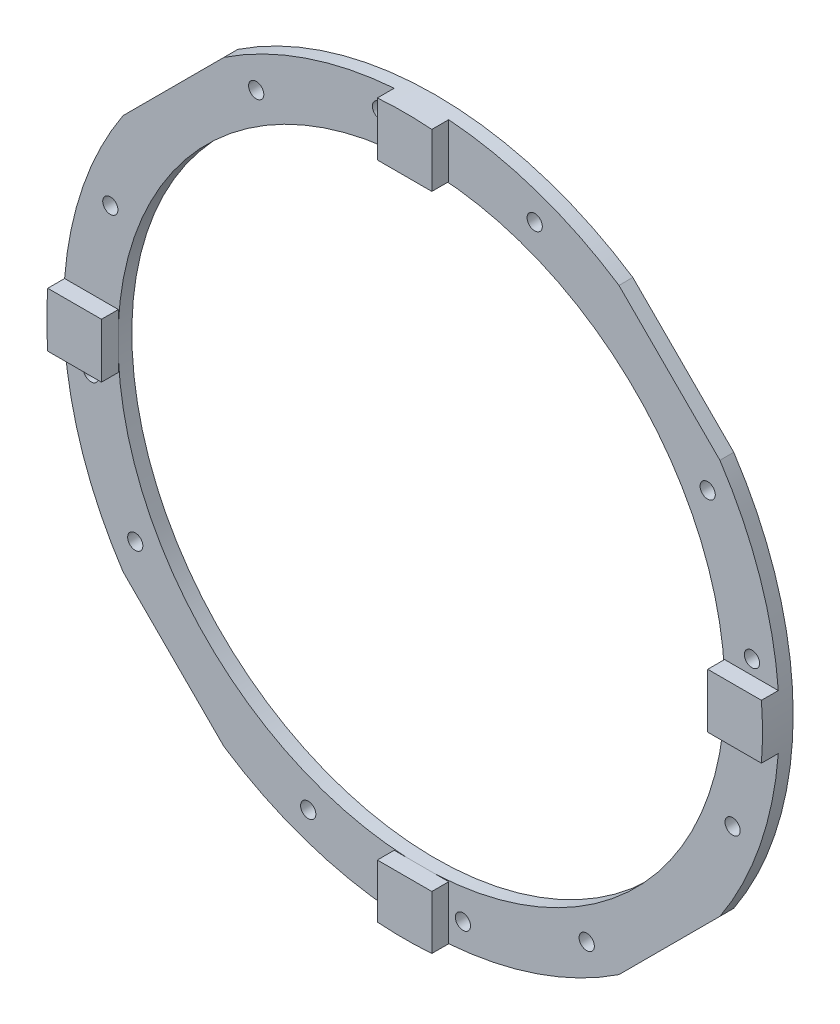
from build123d import *

# Parameters (mm, degrees)
SKETCH2_R           = 129.4
SKETCH2_R_2         = 109.725
SKETCH2_R_3         = 2.75
BOSS_EXTRUDE1_DEPTH = 5
BOSS_EXTRUDE2_DEPTH = 6.1
CUT_EXTRUDE3_DEPTH  = 10
SKETCH5_R           = 2.75
CUT_EXTRUDE4_DEPTH  = 184.335566653


with BuildPart() as part:
    # Sketch2 → Boss-Extrude1 (new body)
    with BuildSketch(Plane.XY):
        Circle(SKETCH2_R)
        Circle(SKETCH2_R_2, mode=Mode.SUBTRACT)
        with Locations(Location((-15, 119.5, 0), (0, 0, 180))):
            Circle(SKETCH2_R_3, mode=Mode.SUBTRACT)
        with Locations((40.94836166, 112.504699024)):
            Circle(SKETCH2_R_3, mode=Mode.SUBTRACT)
        with Locations(Location((119.5, 15, 0), (0, 0, 180))):
            Circle(SKETCH2_R_3, mode=Mode.SUBTRACT)
        with Locations((112.504699024, -40.94836166)):
            Circle(SKETCH2_R_3, mode=Mode.SUBTRACT)
        with Locations(Location((15, -119.5, 0), (0, 0, 180))):
            Circle(SKETCH2_R_3, mode=Mode.SUBTRACT)
        with Locations((-40.94836166, -112.504699024)):
            Circle(SKETCH2_R_3, mode=Mode.SUBTRACT)
        with Locations(Location((-119.5, -15, 0), (0, 0, 180))):
            Circle(SKETCH2_R_3, mode=Mode.SUBTRACT)
        with Locations((-112.504699024, 40.94836166)):
            Circle(SKETCH2_R_3, mode=Mode.SUBTRACT)
    extrude(amount=BOSS_EXTRUDE1_DEPTH)

    # Sketch3 → Boss-Extrude2 (add)
    with BuildSketch(Plane.XY.offset(5)):
        with BuildLine():
            Line((-9.85, 129.024561615), (-9.85, 109.6))
            Line((-9.85, 109.6), (9.85, 109.6))
            Line((9.85, 109.6), (9.85, 129.024561615))
            ThreePointArc((9.85, 129.024561615), (0, 129.4), (-9.85, 129.024561615))
        make_face()
        with BuildLine():
            Line((129.024561615, 9.85), (109.6, 9.85))
            Line((109.6, 9.85), (109.6, -9.85))
            Line((109.6, -9.85), (129.024561615, -9.85))
            ThreePointArc((129.024561615, -9.85), (129.4, 0), (129.024561615, 9.85))
        make_face()
        with BuildLine():
            Line((9.85, -129.024561615), (9.85, -109.6))
            Line((9.85, -109.6), (-9.85, -109.6))
            Line((-9.85, -109.6), (-9.85, -129.024561615))
            ThreePointArc((-9.85, -129.024561615), (0, -129.4), (9.85, -129.024561615))
        make_face()
        with BuildLine():
            Line((-129.024561615, -9.85), (-109.6, -9.85))
            Line((-109.6, -9.85), (-109.6, 9.85))
            Line((-109.6, 9.85), (-129.024561615, 9.85))
            ThreePointArc((-129.024561615, 9.85), (-129.4, 0), (-129.024561615, -9.85))
        make_face()
    extrude(amount=BOSS_EXTRUDE2_DEPTH)

    # Sketch4 → Cut-Extrude3 (cut)
    with BuildSketch(Plane.XY):
        Polygon((126.8, 52.522279709), (52.522279709, 126.8), (53.640656327, 129.5), (129.5, 53.640656327), align=None)
        Polygon((-53.640656327, 129.5), (-129.5, 53.640656327), (-126.8, 52.522279709), (-52.522279709, 126.8), align=None)
        Polygon((-129.5, -53.640656327), (-53.640656327, -129.5), (-52.522279709, -126.8), (-126.8, -52.522279709), align=None)
        Polygon((53.640656327, -129.5), (129.5, -53.640656327), (126.8, -52.522279709), (52.522279709, -126.8), align=None)
    extrude(amount=CUT_EXTRUDE3_DEPTH, mode=Mode.SUBTRACT)

    # Sketch5 → Cut-Extrude4 (cut, through all)
    with BuildSketch(Plane.XY):
        with Locations((103.490035752, 59.75)):
            Circle(SKETCH5_R)
        with Locations((59.75, -103.490035752)):
            Circle(SKETCH5_R)
        with Locations((-103.490035752, -59.75)):
            Circle(SKETCH5_R)
        with Locations((-59.75, 103.490035752)):
            Circle(SKETCH5_R)
    extrude(amount=CUT_EXTRUDE4_DEPTH, mode=Mode.SUBTRACT)


solid = part.part
